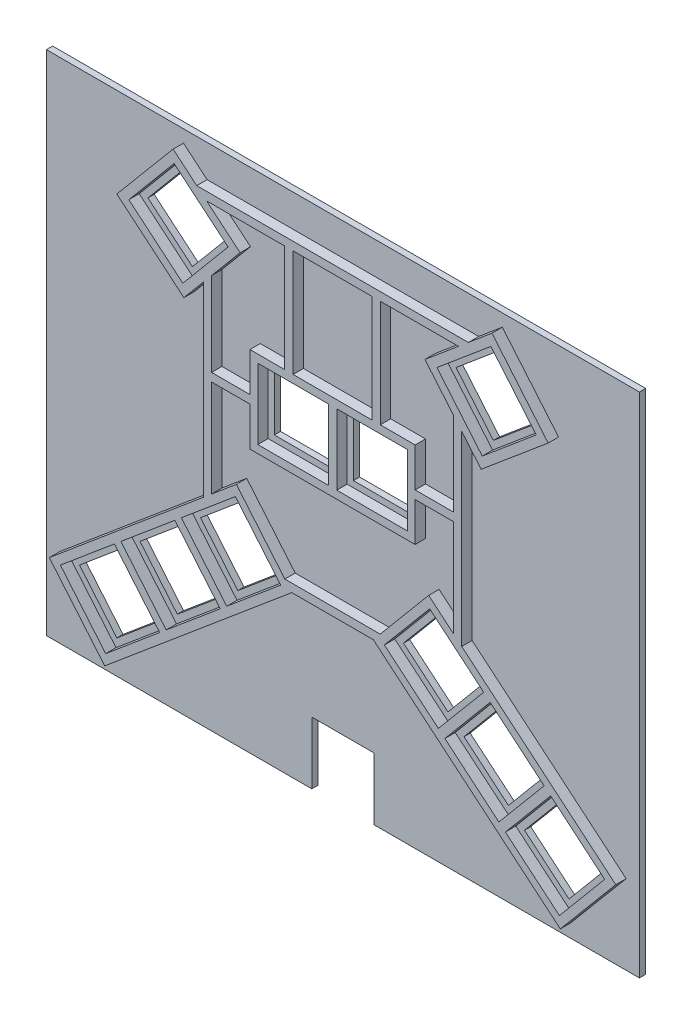
from build123d import *

# Parameters (mm, degrees)
MODEL_W                    = 143.05
MODEL_H                    = 122.397505408
MODEL_W_2                  = 14
MODEL_H_2                  = 14
SALIENTE_EXTRUIR1_DEPTH    = 0.75
CROQUIS2_W                 = 15
CROQUIS2_H                 = 30
CORTAR_EXTRUIR1_DEPTH      = 183.633846224
CROQUIS5_W                 = 19.05
CROQUIS5_H                 = 25.819944505
CROQUIS5_W_2               = 17
CROQUIS5_H_2               = 17
SALIENTE_EXTRUIR2_DEPTH    = 2.5
S_LIDO_MOVER_COPIAR1_ANGLE = 180


with BuildPart() as part:
    # Model → Saliente-Extruir1 (new, symmetric)
    with BuildSketch(Plane.XY):
        with Locations((67.525, 57.198752704)):
            Rectangle(MODEL_W, MODEL_H)
        with Locations((58, 42)):
            Rectangle(MODEL_W_2, MODEL_H_2, mode=Mode.SUBTRACT)
        Polygon((18.593146641, 87.427779239), (29.317768845, 78.428752704), (38.316795381, 89.153374907), (27.592173177, 98.152401443), align=None, mode=Mode.SUBTRACT)
        Polygon((103.814404332, 23.723648739), (114.539026536, 14.724622204), (105.54, 4), (94.815377796, 12.999026536), align=None, mode=Mode.SUBTRACT)
        Polygon((33.186293283, 75.182675275), (43.910915486, 66.183648739), (52.909942022, 76.908270943), (42.185319818, 85.907297479), align=None, mode=Mode.SUBTRACT)
        Polygon((20.510973464, 14.724622204), (29.51, 4), (40.234622204, 12.999026536), (31.235595668, 23.723648739), align=None, mode=Mode.SUBTRACT)
        with Locations((77.05, 42)):
            Rectangle(MODEL_W_2, MODEL_H_2, mode=Mode.SUBTRACT)
        Polygon((92.864680182, 85.907297479), (101.863706717, 75.182675275), (91.139084514, 66.183648739), (82.140057978, 76.908270943), align=None, mode=Mode.SUBTRACT)
        Polygon((107.457826823, 98.152401443), (116.456853359, 87.427779239), (105.732231155, 78.428752704), (96.733204619, 89.153374907), align=None, mode=Mode.SUBTRACT)
        Polygon((4, 99.672883204), (14.724622204, 90.673856668), (23.723648739, 101.398478872), (12.999026536, 110.397505408), align=None, mode=Mode.SUBTRACT)
        Polygon((120.325377796, 90.673856668), (111.326351261, 101.398478872), (122.050973464, 110.397505408), (131.05, 99.672883204), align=None, mode=Mode.SUBTRACT)
    extrude(amount=SALIENTE_EXTRUIR1_DEPTH, both=True)

    # Croquis2 → Cortar-Extruir1 (cut, through all)
    with BuildSketch(Plane.XY.offset(0.75)):
        with Locations((67.525, 118.397505408)):
            Rectangle(CROQUIS2_W, CROQUIS2_H)
    extrude(amount=-CORTAR_EXTRUIR1_DEPTH, mode=Mode.SUBTRACT)

    # Croquis5 → Saliente-Extruir2 (add)
    with BuildSketch(Plane(origin=(0, 0, -0.75), x_dir=(-1, 0, 0), z_dir=(0, 0, -1))):
        Polygon((-122.470046698, 115.187534387), (-135.84002898, 99.25380997), (-98.686873488, 68.0786109), (-98.686873488, 23.135715021), (-103.376842573, 28.725002527), (-119.540380323, 15.162183962), (-105.977561759, -1.001353787), (-100.279300069, 3.780055495), (-34.770699931, 3.780055495), (-29.072438241, -1.001353787), (-15.509619677, 15.162183962), (-31.673157427, 28.725002527), (-36.363126512, 23.135715021), (-36.363126512, 68.0786109), (0.79002898, 99.25380997), (-12.579953302, 115.187534387), (-57.699971002, 77.327344177), (-77.350028998, 77.327344177), align=None)
        Polygon((-45.235975991, 12.561464777), (-37.154207116, 5.780055495), (-56, 5.780055495), (-56, 31.6), (-47.6, 31.6), (-47.6, 41), (-38.363126512, 41), (-38.363126512, 20.752207835), align=None, mode=Mode.SUBTRACT)
        with Locations((-67.525, 18.690027748)):
            Rectangle(CROQUIS5_W, CROQUIS5_H, mode=Mode.SUBTRACT)
        Polygon((-79.05, 5.780055495), (-97.895792884, 5.780055495), (-89.814024009, 12.561464777), (-96.686873488, 20.752207835), (-96.686873488, 41), (-87.45, 41), (-87.45, 31.6), (-79.05, 31.6), align=None, mode=Mode.SUBTRACT)
        Polygon((-116.652274615, 14.909507454), (-103.629519082, 25.836896818), (-92.702129717, 12.814141285), (-105.72488525, 1.886751921), align=None, mode=Mode.SUBTRACT)
        with Locations((-77.05, 42)):
            Rectangle(CROQUIS5_W_2, CROQUIS5_H_2, mode=Mode.SUBTRACT)
        Polygon((-42.347870283, 12.814141285), (-31.420480918, 25.836896818), (-18.397725385, 14.909507454), (-29.32511475, 1.886751921), align=None, mode=Mode.SUBTRACT)
        with Locations((-58, 42)):
            Rectangle(CROQUIS5_W_2, CROQUIS5_H_2, mode=Mode.SUBTRACT)
        Polygon((-103.976954796, 74.997790025), (-93.049565432, 88.020545558), (-80.026809899, 77.093156193), (-90.954199263, 64.07040066), align=None, mode=Mode.SUBTRACT)
        Polygon((-133.163248079, 99.487997954), (-122.235858715, 112.510753487), (-109.213103182, 101.583364122), (-120.140492546, 88.560608589), align=None, mode=Mode.SUBTRACT)
        Polygon((-118.570101438, 87.242893989), (-107.642712073, 100.265649522), (-94.61995654, 89.338260158), (-105.547345905, 76.315504625), align=None, mode=Mode.SUBTRACT)
        Polygon((-96.686873488, 66.400411638), (-90.72001128, 61.39361976), (-79.028228261, 75.327344177), (-56.021771739, 75.327344177), (-44.32998872, 61.39361976), (-38.363126512, 66.400411638), (-38.363126512, 43), (-47.6, 43), (-47.6, 52.4), (-87.45, 52.4), (-87.45, 43), (-96.686873488, 43), align=None, mode=Mode.SUBTRACT)
        Polygon((-44.095800737, 64.07040066), (-55.023190101, 77.093156193), (-42.000434568, 88.020545558), (-31.073045204, 74.997790025), align=None, mode=Mode.SUBTRACT)
        Polygon((-29.502654095, 76.315504625), (-40.43004346, 89.338260158), (-27.407287927, 100.265649522), (-16.479898562, 87.242893989), align=None, mode=Mode.SUBTRACT)
        Polygon((-14.909507454, 88.560608589), (-25.836896818, 101.583364122), (-12.814141285, 112.510753487), (-1.886751921, 99.487997954), align=None, mode=Mode.SUBTRACT)
    extrude(amount=SALIENTE_EXTRUIR2_DEPTH)


with BuildPart() as part_1:
    # Sólido-Mover/Copiar1: moved
    add(part.part.rotate(Axis((0, 57.198752704, -0.75), (1, 0, 0)), S_LIDO_MOVER_COPIAR1_ANGLE))


solid = part_1.part
